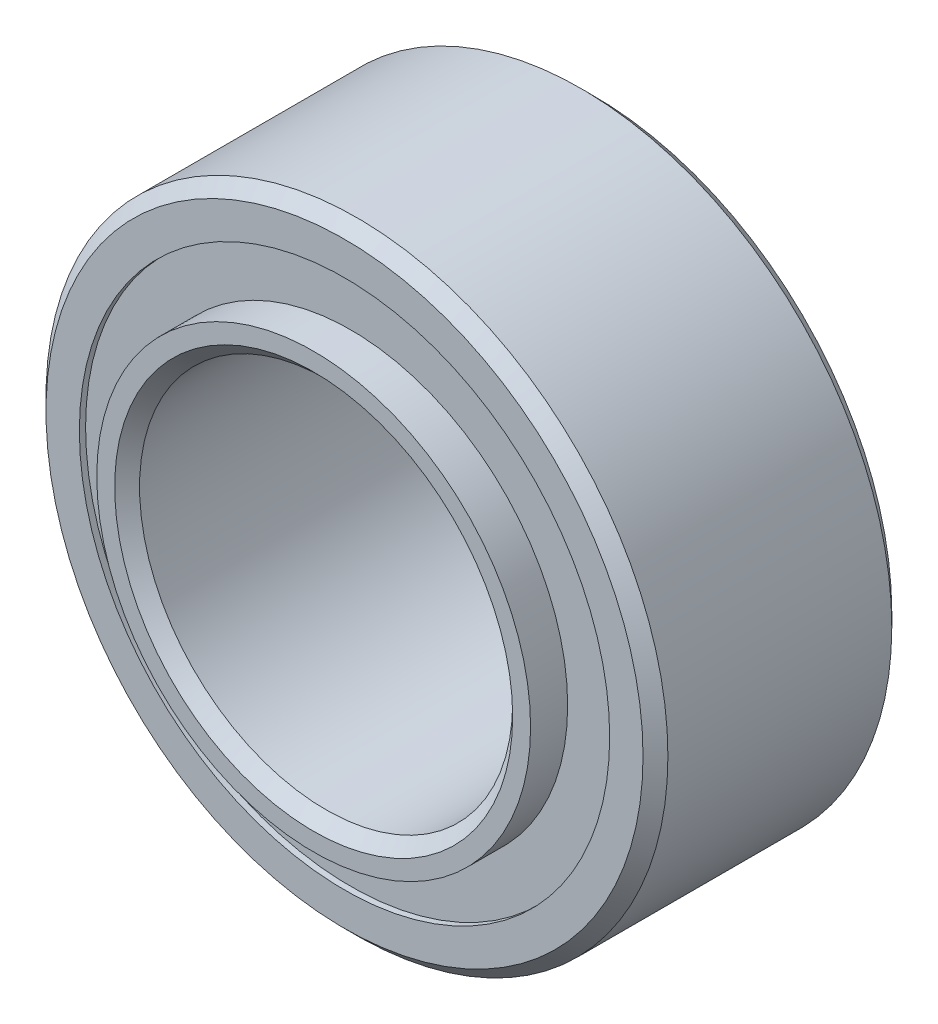
from build123d import *

# Parameters (mm, degrees)
CIRPATTERN1_COUNT = 10
SKETCH5_W         = 0.772168375
SKETCH5_H         = 0.615740659


with BuildPart() as part:
    # Sketch1 → Revolve1 (revolve)
    with BuildSketch(Plane(origin=(0, 0, 0), x_dir=(0, 0, -1), z_dir=(1, 0, 0))):
        with BuildLine():
            Line((1.42875, 3.96875), (-1.42875, 3.96875))
            Line((-1.42875, 3.96875), (-1.5875, 3.81))
            Line((-1.5875, 3.81), (-1.5875, 3.384340659))
            Line((-1.5875, 3.384340659), (-0.705555556, 3.384340659))
            ThreePointArc((-0.705555556, 3.384340659), (0, 3.910956625), (0.705555556, 3.384340659))
            Line((0.705555556, 3.384340659), (1.5875, 3.384340659))
            Line((1.5875, 3.384340659), (1.5875, 3.81))
            Line((1.5875, 3.81), (1.42875, 3.96875))
        make_face()
    revolve(axis=Axis((0, 0, 1.5875), (0, 0, -1)))


with BuildPart() as body_2:
    # Sketch3 → Revolve3 (revolve)
    with BuildSketch(Plane(origin=(0, 0, 0), x_dir=(0, 0, -1), z_dir=(1, 0, 0))):
        Polygon((-1.9812, 2.54), (-1.9812, 2.7686), (1.9812, 2.7686), (1.9812, 2.54), (1.82245, 2.38125), (-1.82245, 2.38125), align=None)
    revolve(axis=Axis((0, 0, 1.5875), (0, 0, -1)))


with BuildPart() as body_3:
    # Sketch4 → Revolve4 (revolve)
    with BuildSketch(Plane(origin=(0, 0, 0), x_dir=(0, 0, -1), z_dir=(1, 0, 0))):
        with BuildLine():
            Line((-0.735956625, 3.175), (0.735956625, 3.175))
            ThreePointArc((0.735956625, 3.175), (0, 3.910956625), (-0.735956625, 3.175))
        make_face()
    revolve(axis=Axis((0, 3.175, 0.735956625), (0, 0, -1)))


with BuildPart() as cirpattern1_1:
    # CirPattern1: pattern copy
    add(body_3.part.rotate(Axis((0, 0, -1.5875), (0, 0, 1)), 1 * 360 / CIRPATTERN1_COUNT))


with BuildPart() as cirpattern1_2:
    # CirPattern1: pattern copy
    add(body_3.part.rotate(Axis((0, 0, -1.5875), (0, 0, 1)), 2 * 360 / CIRPATTERN1_COUNT))


with BuildPart() as cirpattern1_3:
    # CirPattern1: pattern copy
    add(body_3.part.rotate(Axis((0, 0, -1.5875), (0, 0, 1)), 3 * 360 / CIRPATTERN1_COUNT))


with BuildPart() as cirpattern1_4:
    # CirPattern1: pattern copy
    add(body_3.part.rotate(Axis((0, 0, -1.5875), (0, 0, 1)), 4 * 360 / CIRPATTERN1_COUNT))


with BuildPart() as cirpattern1_5:
    # CirPattern1: pattern copy
    add(body_3.part.rotate(Axis((0, 0, -1.5875), (0, 0, 1)), 5 * 360 / CIRPATTERN1_COUNT))


with BuildPart() as cirpattern1_6:
    # CirPattern1: pattern copy
    add(body_3.part.rotate(Axis((0, 0, -1.5875), (0, 0, 1)), 6 * 360 / CIRPATTERN1_COUNT))


with BuildPart() as cirpattern1_7:
    # CirPattern1: pattern copy
    add(body_3.part.rotate(Axis((0, 0, -1.5875), (0, 0, 1)), 7 * 360 / CIRPATTERN1_COUNT))


with BuildPart() as cirpattern1_8:
    # CirPattern1: pattern copy
    add(body_3.part.rotate(Axis((0, 0, -1.5875), (0, 0, 1)), 8 * 360 / CIRPATTERN1_COUNT))


with BuildPart() as cirpattern1_9:
    # CirPattern1: pattern copy
    add(body_3.part.rotate(Axis((0, 0, -1.5875), (0, 0, 1)), 9 * 360 / CIRPATTERN1_COUNT))


with BuildPart() as body_13:
    # Sketch5 → Revolve5 (revolve)
    with BuildSketch(Plane(origin=(0, 0, 0), x_dir=(0, 0, -1), z_dir=(1, 0, 0))):
        with Locations((-1.122040813, 3.07647033)):
            Rectangle(SKETCH5_W, SKETCH5_H)
        with Locations((1.122040813, 3.07647033)):
            Rectangle(SKETCH5_W, SKETCH5_H)
    revolve(axis=Axis((0, 0, 1.5875), (0, 0, -1)))


solid = Compound([part.part, body_2.part, body_3.part, cirpattern1_1.part, cirpattern1_2.part, cirpattern1_3.part, cirpattern1_4.part, cirpattern1_5.part, cirpattern1_6.part, cirpattern1_7.part, cirpattern1_8.part, cirpattern1_9.part, body_13.part])
